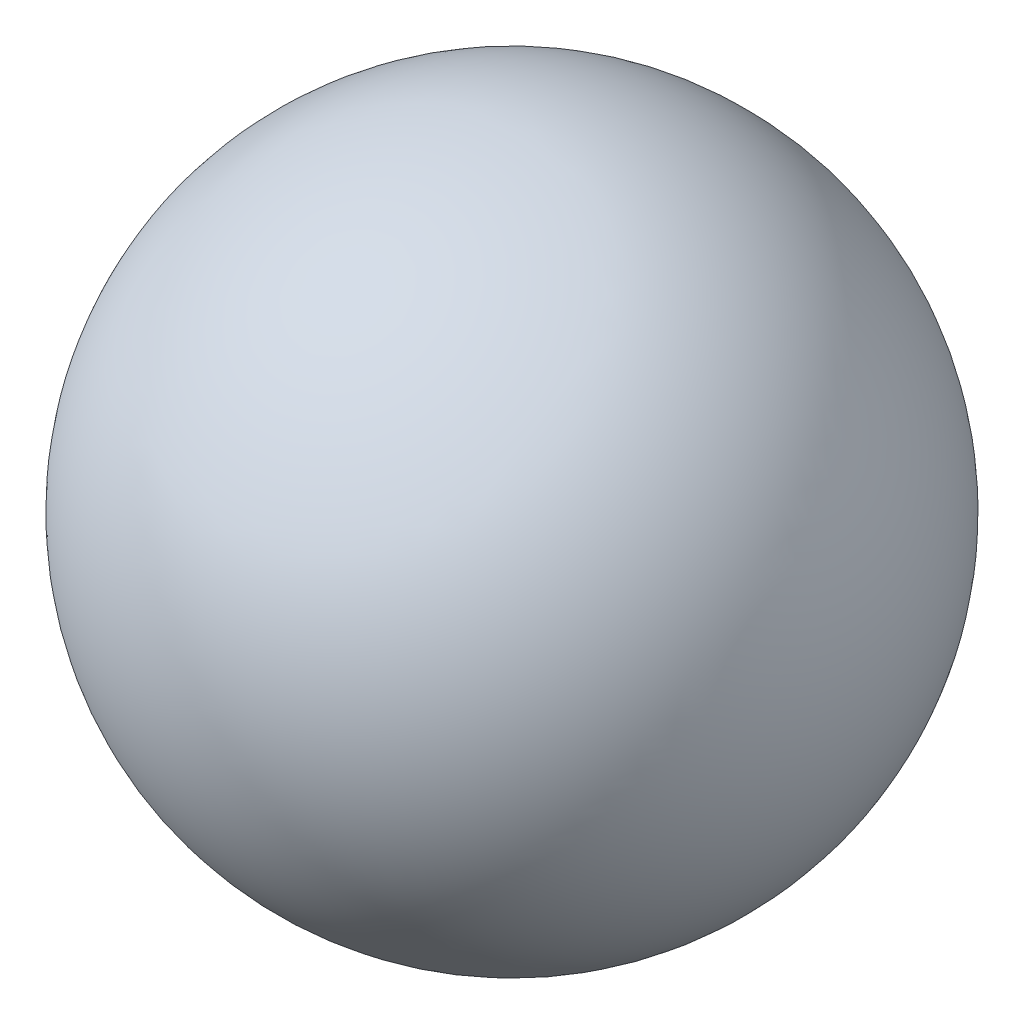
from build123d import *


with BuildPart() as part:
    # Sketch1 → Revolve1 (revolve)
    with BuildSketch(Plane.XY):
        with BuildLine():
            Line((0, 0), (-4, 0))
            ThreePointArc((-4, 0), (0, -4), (4, 0))
            Line((4, 0), (0, 0))
        make_face()
    revolve(axis=Axis((0, 0, 0), (1, 0, 0)))


solid = part.part
